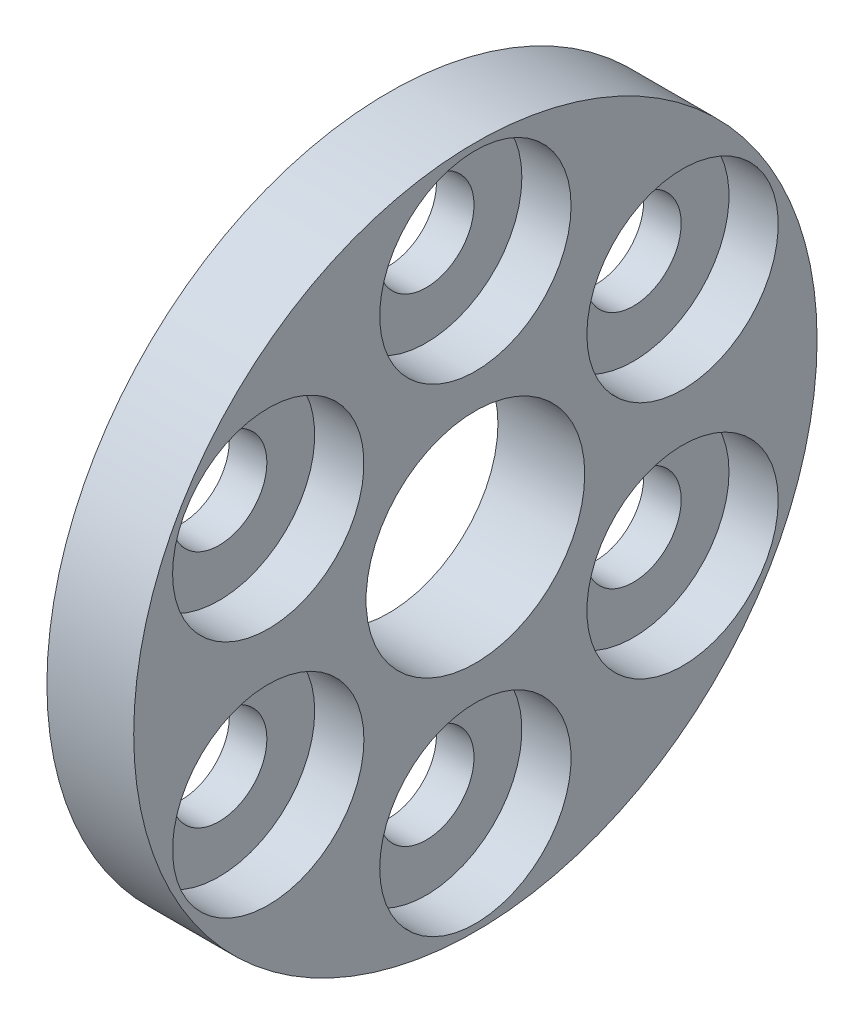
from build123d import *

# Parameters (mm, degrees)
SKETCH1_R           = 12.5
BOSS_EXTRUDE1_DEPTH = 3.175
SKETCH3_R           = 4
CUT_EXTRUDE1_DEPTH  = 18.960529641
SKETCH2_R           = 1.75
CUT_EXTRUDE2_DEPTH  = 18.960529641
SKETCH4_R           = 3.5
SKETCH4_R_2         = 1.75
CUT_EXTRUDE3_DEPTH  = 1.8
CIRPATTERN1_COUNT   = 6


with BuildPart() as part:
    # Sketch1 → Boss-Extrude1 (new body)
    with BuildSketch(Plane(origin=(0, 0, 0), x_dir=(0, 0, -1), z_dir=(1, 0, 0))):
        Circle(SKETCH1_R)
    extrude(amount=BOSS_EXTRUDE1_DEPTH)

    # Sketch3 → Cut-Extrude1 (cut, through all)
    with BuildSketch(Plane(origin=(3.175, 0, 0), x_dir=(0, 0, -1), z_dir=(1, 0, 0))):
        Circle(SKETCH3_R)
    extrude(amount=-CUT_EXTRUDE1_DEPTH, mode=Mode.SUBTRACT)

    # Sketch2 → Cut-Extrude2 (cut, through all)
    with BuildSketch(Plane(origin=(3.175, 0, 0), x_dir=(0, 0, -1), z_dir=(1, 0, 0))):
        with Locations((0, 8.75)):
            Circle(SKETCH2_R)
    cut_extrude2 = extrude(amount=-CUT_EXTRUDE2_DEPTH, mode=Mode.SUBTRACT)

    # Sketch4 → Cut-Extrude3 (cut)
    # profile 1 of 3: a face of its own
    with BuildSketch(Plane(origin=(3.175, 0, 0), x_dir=(0, 0, -1), z_dir=(1, 0, 0))):
        with Locations((0, 8.75)):
            Circle(SKETCH4_R)
        Polygon((3.175426481, 8.75), (1.58771324, 11.5), (-1.58771324, 11.5), (-3.175426481, 8.75), (-1.58771324, 6), (1.58771324, 6), align=None, mode=Mode.SUBTRACT)
    # profile 2 of 3: a face of its own
    with BuildSketch(Plane(origin=(3.175, 0, 0), x_dir=(0, 0, -1), z_dir=(1, 0, 0))):
        Polygon((1.58771324, 6), (3.175426481, 8.75), (1.58771324, 11.5), (-1.58771324, 11.5), (-3.175426481, 8.75), (-1.58771324, 6), align=None)
        with Locations((0, 8.75)):
            Circle(SKETCH4_R_2, mode=Mode.SUBTRACT)
    # profile 3 of 3: a face of its own
    with BuildSketch(Plane(origin=(3.175, 0, 0), x_dir=(0, 0, -1), z_dir=(1, 0, 0))):
        with Locations((0, 8.75)):
            Circle(SKETCH4_R_2)
    cut_extrude3 = extrude(amount=-CUT_EXTRUDE3_DEPTH, mode=Mode.SUBTRACT)

    # CirPattern1: Cut-Extrude2, Cut-Extrude3 ×6 about axis
    cirpattern1_axis = Axis((0, 0, 0), (1, 0, 0))
    add([cut_extrude2.rotate(cirpattern1_axis, i * 360 / CIRPATTERN1_COUNT) for i in range(1, CIRPATTERN1_COUNT)], mode=Mode.SUBTRACT)
    add([cut_extrude3.rotate(cirpattern1_axis, i * 360 / CIRPATTERN1_COUNT) for i in range(1, CIRPATTERN1_COUNT)], mode=Mode.SUBTRACT)


solid = part.part
